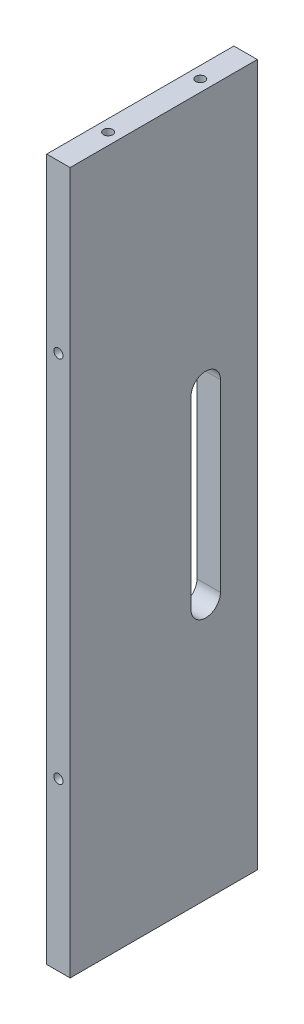
from build123d import *

# Parameters (mm, degrees)
PARED_X_1_4IN_START           = -139.7
CROQUIS1_W                    = 50.8
CROQUIS1_H                    = 190.5
PARED_X_1_4IN_DEPTH           = 6.35
ROSCA_M3_INFERIOR_START       = 12.7
CROQUIS2_R                    = 1.25
ROSCA_M3_INFERIOR_DEPTH       = 10
ROSCA_M3_SUPERIOR_START       = 53.5
CROQUIS3_R                    = 1.25
ROSCA_M3_SUPERIOR_DEPTH       = 10
ROSCA_M3_ESQUINA_Y_START      = 85.25
CROQUIS4_R                    = 1.25
ROSCA_M3_ESQUINA_Y_DEPTH      = 10
ROSCA_M3_ESQUINA_Y_START_2    = -95.25
CROQUIS5_R                    = 1.25
ROSCA_M3_ESQUINA_Y_2_DEPTH    = 10
PASO_CABLE_ALIMENTACION_START = -139.7
PASO_CABLE_ALIMENTACION_DEPTH = 6.35


with BuildPart() as part:
    # Croquis1 → Pared_X_1-4in (new body)
    with BuildSketch(Plane(origin=(0, 0, 0), x_dir=(0, 0, -1), z_dir=(1, 0, 0)).offset(PARED_X_1_4IN_START)):
        with Locations((-38.1, 0)):
            Rectangle(CROQUIS1_W, CROQUIS1_H)
    extrude(amount=PARED_X_1_4IN_DEPTH)

    # Croquis2 → Rosca_M3_inferior (cut)
    with BuildSketch(Plane.XY.offset(ROSCA_M3_INFERIOR_START)):
        with Locations((-136.525, -50)):
            Circle(CROQUIS2_R)
        with Locations((-136.525, 50)):
            Circle(CROQUIS2_R)
    extrude(amount=ROSCA_M3_INFERIOR_DEPTH, mode=Mode.SUBTRACT)

    # Croquis3 → Rosca_M3_superior (cut)
    with BuildSketch(Plane.XY.offset(ROSCA_M3_SUPERIOR_START)):
        with Locations((-136.525, -50)):
            Circle(CROQUIS3_R)
        with Locations((-136.525, 50)):
            Circle(CROQUIS3_R)
    extrude(amount=ROSCA_M3_SUPERIOR_DEPTH, mode=Mode.SUBTRACT)

    # Croquis4 → Rosca_M3_esquina__Y (cut)
    with BuildSketch(Plane(origin=(0, 0, 0), x_dir=(1, 0, 0), z_dir=(0, 1, 0)).offset(ROSCA_M3_ESQUINA_Y_START)):
        with Locations(Location((-136.525, -25, 0), (0, 0, 270))):
            Circle(CROQUIS4_R)
        with Locations(Location((-136.525, -50, 0), (0, 0, 270))):
            Circle(CROQUIS4_R)
    extrude(amount=ROSCA_M3_ESQUINA_Y_DEPTH, mode=Mode.SUBTRACT)

    # Croquis5 → Rosca_M3_esquina_-Y 2 (cut)
    with BuildSketch(Plane(origin=(0, 0, 0), x_dir=(1, 0, 0), z_dir=(0, 1, 0)).offset(ROSCA_M3_ESQUINA_Y_START_2)):
        with Locations(Location((-136.525, -25, 0), (0, 0, 270))):
            Circle(CROQUIS5_R)
        with Locations(Location((-136.525, -50, 0), (0, 0, 270))):
            Circle(CROQUIS5_R)
    extrude(amount=ROSCA_M3_ESQUINA_Y_2_DEPTH, mode=Mode.SUBTRACT)

    # Croquis6 → Paso_cable_alimentacion (cut)
    with BuildSketch(Plane(origin=(0, 0, 0), x_dir=(0, 0, -1), z_dir=(1, 0, 0)).offset(PASO_CABLE_ALIMENTACION_START)):
        with BuildLine():
            Line((-30.7, -25), (-30.7, 25))
            ThreePointArc((-30.7, 25), (-26.7, 29), (-22.7, 25))
            Line((-22.7, 25), (-22.7, -25))
            ThreePointArc((-22.7, -25), (-26.7, -29), (-30.7, -25))
        make_face()
    extrude(amount=PASO_CABLE_ALIMENTACION_DEPTH, mode=Mode.SUBTRACT)


solid = part.part
